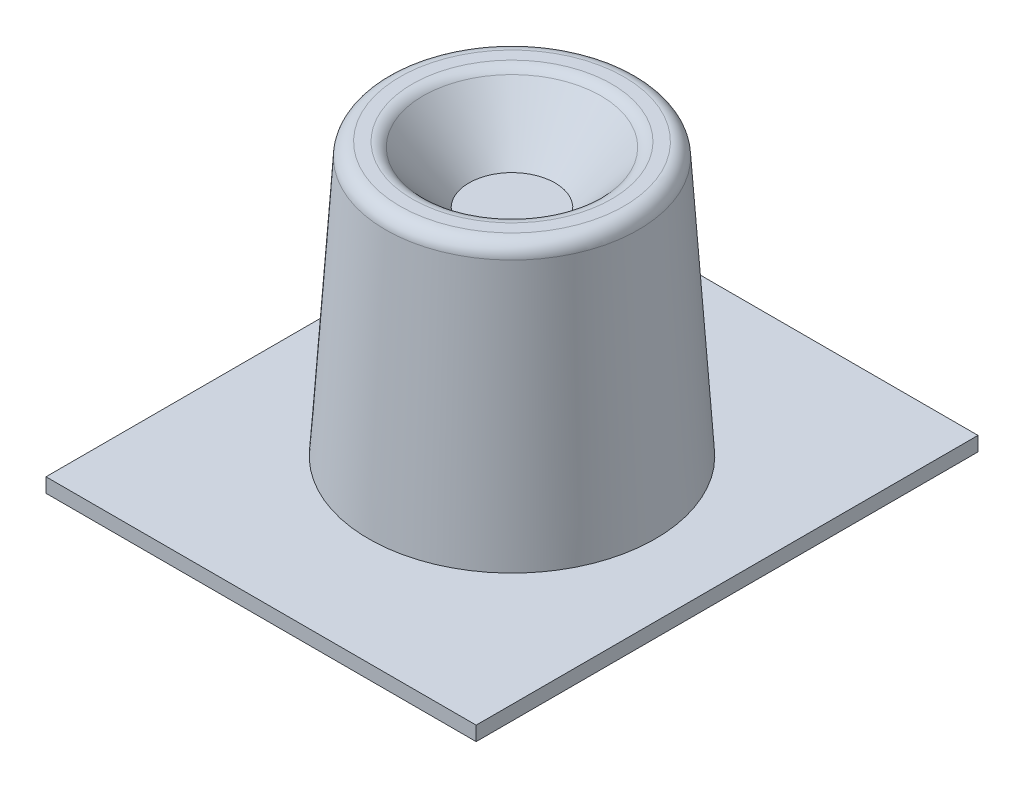
from build123d import *

# Parameters (mm, degrees)
CONG_1_R           = 1
ESQUISSE2_W        = 30
ESQUISSE2_H        = 35
BOSS_EXTRU_1_DEPTH = 1


with BuildPart() as part:
    # Esquisse1 → Révolution1 (revolve)
    with BuildSketch(Plane.XY, mode=Mode.PRIVATE) as r_volution1_sk:
        Polygon((0, 19.136127235), (3, 19.136127235), (6.5, 23.136127235), (8.75, 23.136127235), (10, 4.136127235), (0, 4.136127235), align=None)
    revolve(r_volution1_sk.sketch.rotate(Axis((0, 0, 0), (0, 1, 0)), 90), axis=Axis((0, 0, 0), (0, 1, 0)))

    # Congé1
    cong_1_edges = [part.edges().sort_by_distance(p)[0] for p in [
        (0, 23.136127235, 8.75),
        (0, 23.136127235, 6.5),
    ]]
    fillet(cong_1_edges, radius=CONG_1_R)

    # Esquisse2 → Boss.-Extru.1 (add)
    with BuildSketch(Plane.XZ.offset(-4.136127235)):
        Rectangle(ESQUISSE2_W, ESQUISSE2_H)
    extrude(amount=BOSS_EXTRU_1_DEPTH)


solid = part.part
